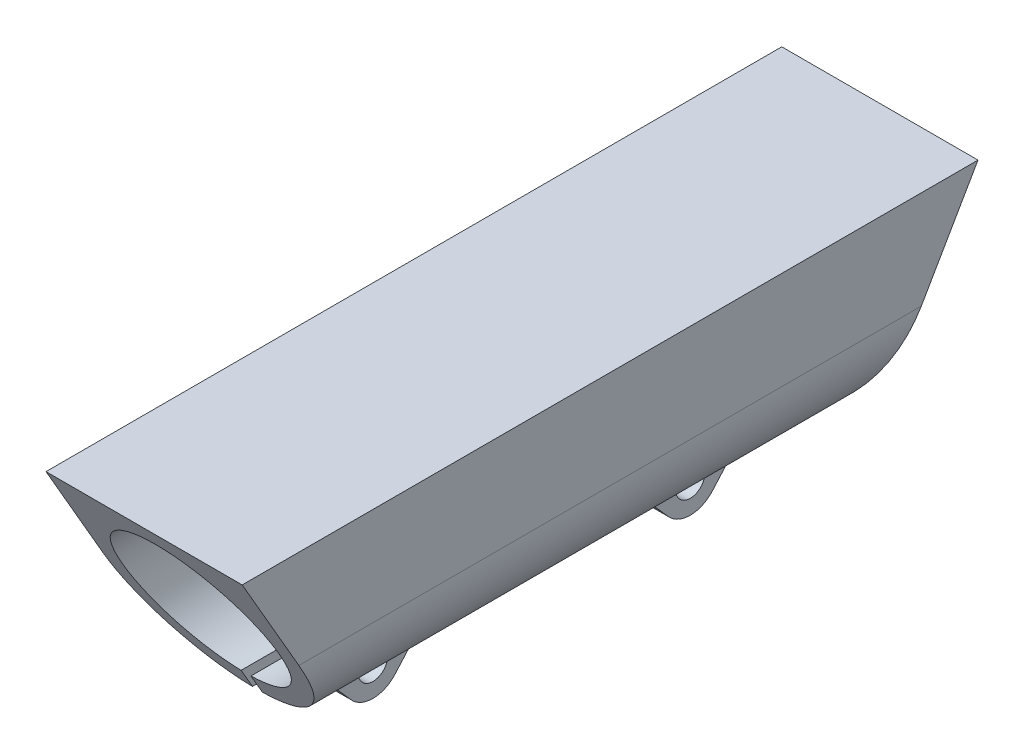
from build123d import *

# Parameters (mm, degrees)
SALIENTE_EXTRUIR1_DEPTH    = 75
CROQUIS2_R                 = 1.5
SALIENTE_EXTRUIR2_DEPTH    = 2
CORTAR_EXTRUIR1_DEPTH      = 78.076531881
CORTAR_EXTRUIR1_DEPTH_BACK = 78.076531881
CROQUIS5_W                 = 1
CROQUIS5_H                 = 6.705492802
CORTAR_EXTRUIR2_DEPTH      = 78.076531881
CORTAR_EXTRUIR2_DEPTH_BACK = 78.076531881


with BuildPart() as part:
    # Croquis1 → Saliente-Extruir1 (new body)
    with BuildSketch(Plane.XY):
        with BuildLine():
            Line((-10, 10), (10, 10))
            Line((10, 10), (10, 0))
            ThreePointArc((10, 0), (7.245688373, -6.892024376), (0.5, -9.987492178))
            Line((0.5, -9.987492178), (0.5, -7.984359711))
            ThreePointArc((0.5, -7.984359711), (0, 8), (-0.5, -7.984359711))
            Line((-0.5, -7.984359711), (-0.5, -9.987492178))
            ThreePointArc((-0.5, -9.987492178), (-7.245688373, -6.892024376), (-10, 0))
            Line((-10, 0), (-10, 10))
        make_face()
    extrude(amount=SALIENTE_EXTRUIR1_DEPTH)

    # Croquis2 → Saliente-Extruir2 (add, symmetric)
    # profile 1 of 2: a face of its own
    with BuildSketch(Plane(origin=(0, 0, 0), x_dir=(0, 0, -1), z_dir=(1, 0, 0))):
        with BuildLine():
            Line((-60, -9.057857597), (-55.918368417, -13.676465368))
            ThreePointArc((-55.918368417, -13.676465368), (-53.670398363, -14.689852513), (-51.422428309, -13.676465368))
            Line((-51.422428309, -13.676465368), (-47.340796726, -9.057857597))
            Line((-47.340796726, -9.057857597), (-60, -9.057857597))
        make_face()
        with Locations((-53.670398363, -11.689852513)):
            Circle(CROQUIS2_R, mode=Mode.SUBTRACT)
    # profile 2 of 2: a face of its own
    with BuildSketch(Plane(origin=(0, 0, 0), x_dir=(0, 0, -1), z_dir=(1, 0, 0))):
        with BuildLine():
            Line((-15, -9.057857597), (-19.081631583, -13.676465368))
            ThreePointArc((-19.081631583, -13.676465368), (-21.329601637, -14.689852513), (-23.577571691, -13.676465368))
            Line((-23.577571691, -13.676465368), (-27.659203274, -9.057857597))
            Line((-27.659203274, -9.057857597), (-15, -9.057857597))
        make_face()
        with Locations(Location((-21.329601637, -11.689852513, 0), (0, 0, 180))):
            Circle(CROQUIS2_R, mode=Mode.SUBTRACT)
    extrude(amount=SALIENTE_EXTRUIR2_DEPTH, both=True)

    # Croquis5 → Cortar-Extruir1 (cut, two sides: drawn at the far end of the back side and taken through both)
    with BuildSketch(Plane.XY.offset(-CORTAR_EXTRUIR1_DEPTH_BACK)):
        with Locations((0, -11.337106112)):
            Rectangle(CROQUIS5_W, CROQUIS5_H)
    extrude(amount=CORTAR_EXTRUIR1_DEPTH + CORTAR_EXTRUIR1_DEPTH_BACK, mode=Mode.SUBTRACT)

    # Croquis6 → Cortar-Extruir2 (cut, two sides: drawn at the far end of the back side and taken through both)
    with BuildSketch(Plane(origin=(0, 0, 0), x_dir=(0, 0, -1), z_dir=(1, 0, 0)).offset(-CORTAR_EXTRUIR2_DEPTH_BACK)):
        Polygon((-75, 10), (-63.455743468, -9.987492178), (-75, -9.987492178), align=None)
        Polygon((-11.544256532, -9.987492178), (0, -9.987492178), (0, 10), align=None)
    extrude(amount=CORTAR_EXTRUIR2_DEPTH + CORTAR_EXTRUIR2_DEPTH_BACK, mode=Mode.SUBTRACT)


solid = part.part
